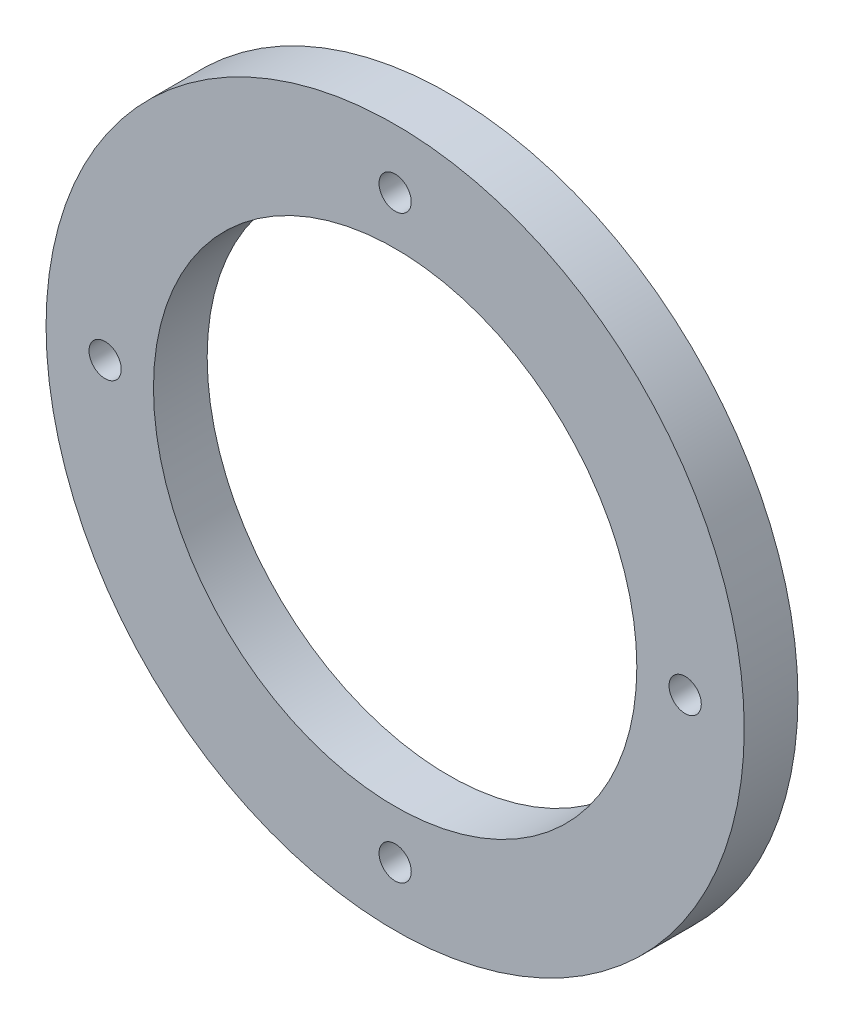
from build123d import *

# Parameters (mm, degrees)
SKETCH1_R           = 32.5
SKETCH1_R_2         = 22.5
SKETCH1_R_3         = 1.5
BOSS_EXTRUDE1_DEPTH = 5


with BuildPart() as part:
    # Sketch1 → Boss-Extrude1 (new body)
    with BuildSketch(Plane.XY):
        Circle(SKETCH1_R)
        Circle(SKETCH1_R_2, mode=Mode.SUBTRACT)
        with Locations((27, 0)):
            Circle(SKETCH1_R_3, mode=Mode.SUBTRACT)
        with Locations((0, 27)):
            Circle(SKETCH1_R_3, mode=Mode.SUBTRACT)
        with Locations((0, -27)):
            Circle(SKETCH1_R_3, mode=Mode.SUBTRACT)
        with Locations((-27, 0)):
            Circle(SKETCH1_R_3, mode=Mode.SUBTRACT)
    extrude(amount=BOSS_EXTRUDE1_DEPTH)


solid = part.part
